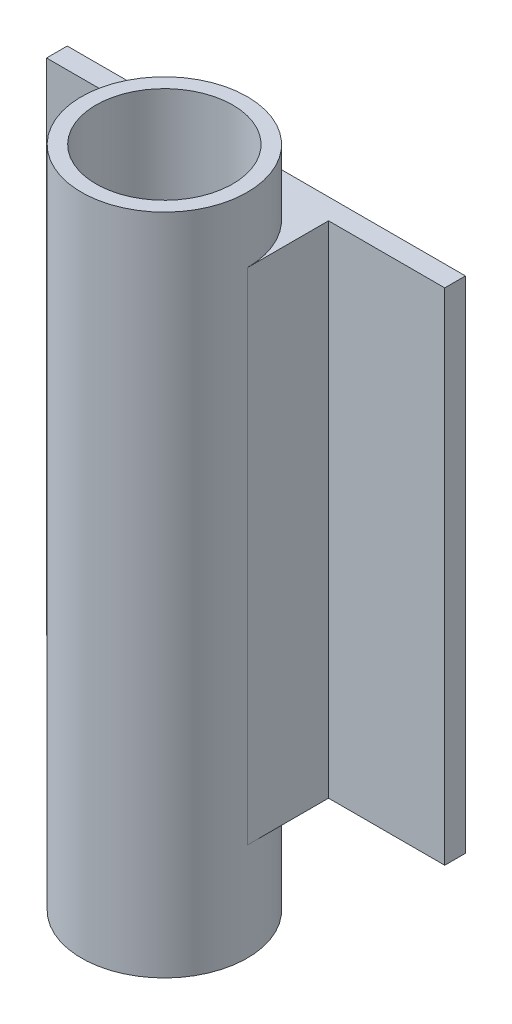
from build123d import *

# Parameters (mm, degrees)
BOSS_EXTRUDE1_START = -153.2
BOSS_EXTRUDE1_DEPTH = 153.2


with BuildPart() as part:
    # Sketch12 → Revolve1 (revolve)
    with BuildSketch(Plane.XY, mode=Mode.PRIVATE) as revolve1_sk:
        Polygon((-25.399999994, 0), (-25.399999994, 203.2), (-20.955, 203.2), (-20.955, 165.1), (-19.177, 165.1), (-19.177, 38.1), (-20.955, 38.1), (-20.955, 0), align=None)
    revolve(revolve1_sk.sketch.rotate(Axis((0, 0, 0), (0, 1, 0)), 270), axis=Axis((0, 0, 0), (0, 1, 0)))

    # Sketch13 → Boss-Extrude1 (add)
    with BuildSketch(Plane(origin=(0, 30, 0), x_dir=(-1, 0, 0), z_dir=(0, -1, 0)).offset(BOSS_EXTRUDE1_START)):
        with BuildLine():
            Line((61, 24.899999994), (61, 31.249999994))
            Line((61, 31.249999994), (-61, 31.249999994))
            Line((-61, 31.249999994), (-61, 24.899999994))
            Line((-61, 24.899999994), (-25.399999994, 24.899999994))
            Line((-25.399999994, 24.899999994), (-25.399999994, 0))
            ThreePointArc((-25.399999994, 0), (0, 25.399999994), (25.399999994, 0))
            Line((25.399999994, 0), (25.399999994, 24.899999994))
            Line((25.399999994, 24.899999994), (61, 24.899999994))
        make_face()
    extrude(amount=BOSS_EXTRUDE1_DEPTH)


solid = part.part
